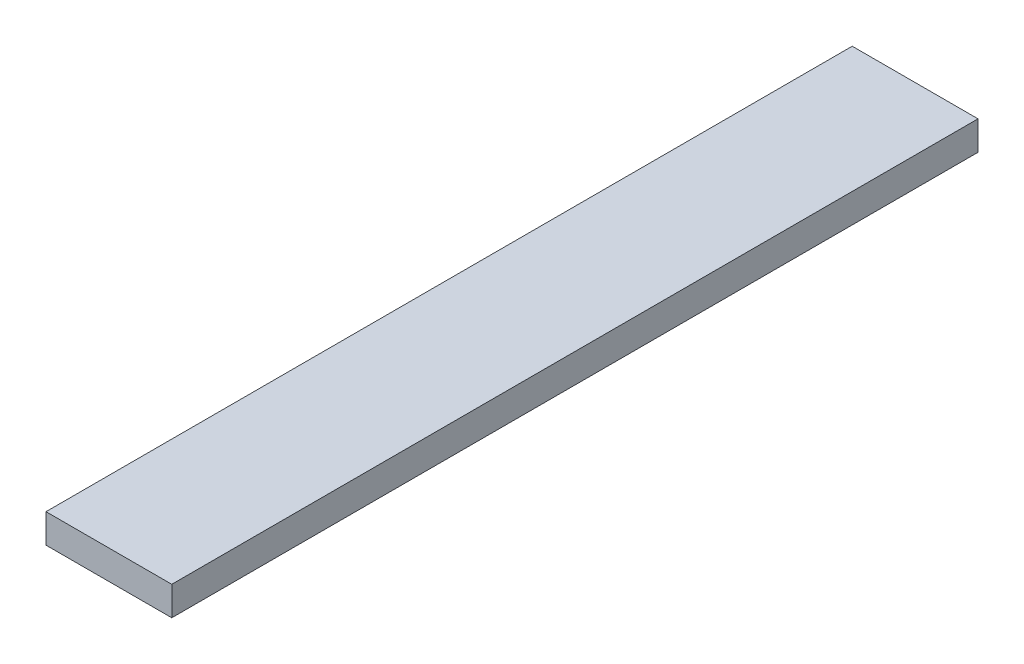
from build123d import *

# Parameters (mm, degrees)
SKETCH1_W           = 78
SKETCH1_H           = 18
BOSS_EXTRUDE1_DEPTH = 500


with BuildPart() as part:
    # Sketch1 → Boss-Extrude1 (new body)
    with BuildSketch(Plane.XY):
        with Locations((39, 9)):
            Rectangle(SKETCH1_W, SKETCH1_H)
    extrude(amount=BOSS_EXTRUDE1_DEPTH)


solid = part.part
